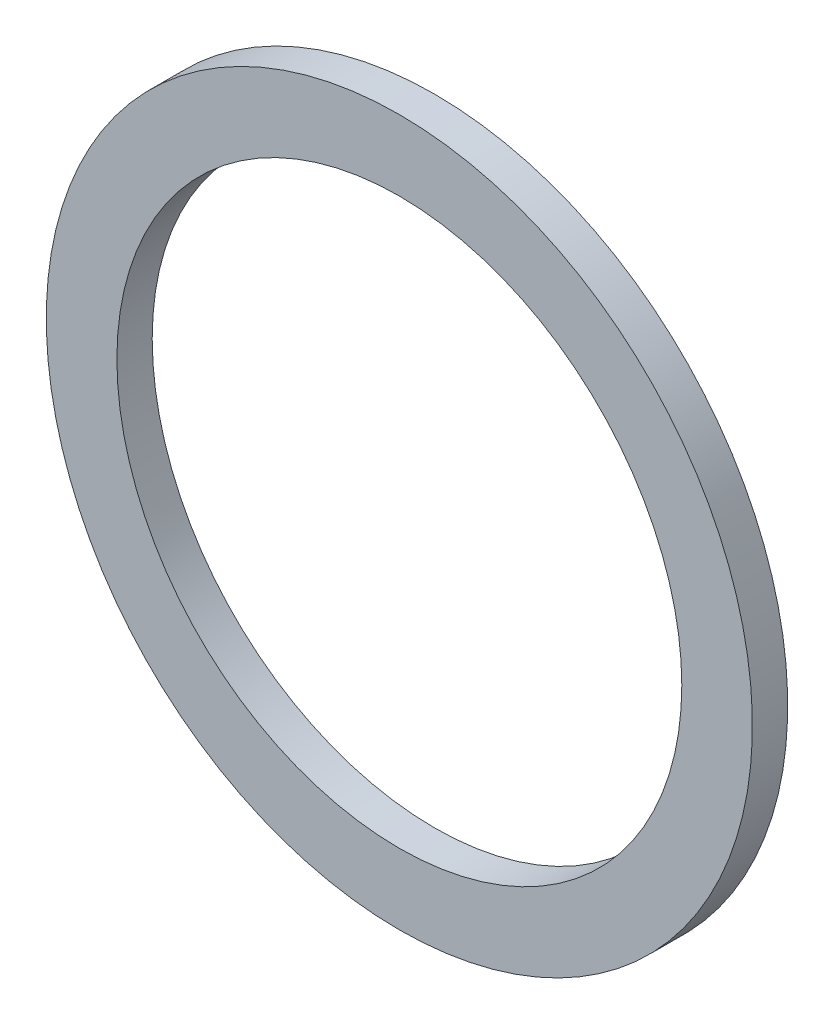
from build123d import *

# Parameters (mm, degrees)
SKETCH1_W = 0.5
SKETCH1_H = 5
SKETCH2_W = 0.5
SKETCH2_H = 4


with BuildPart() as part:
    # Sketch1 → Revolve1 (revolve)
    with BuildSketch(Plane(origin=(0, 0, 0), x_dir=(0, 0, -1), z_dir=(1, 0, 0))):
        with Locations((-0.25, 2.5)):
            Rectangle(SKETCH1_W, SKETCH1_H)
    revolve(axis=Axis((0, 0, 0), (0, 0, 1)))

    # Sketch2 → Cut-Revolve1 (revolve, cut)
    with BuildSketch(Plane(origin=(0, 0, 0), x_dir=(0, 0, -1), z_dir=(1, 0, 0))):
        with Locations((-0.25, 2)):
            Rectangle(SKETCH2_W, SKETCH2_H)
    revolve(axis=Axis((0, 0, 0), (0, 0, 1)), mode=Mode.SUBTRACT)


solid = part.part
